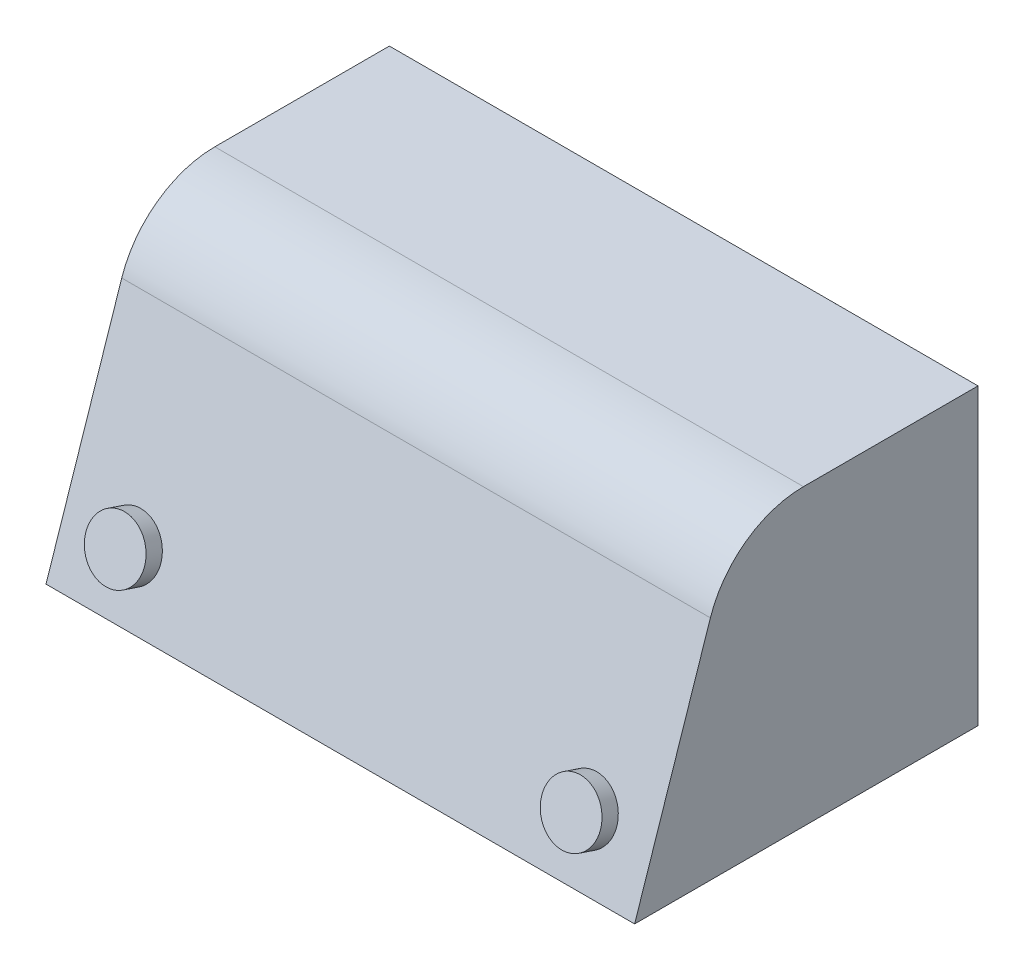
from build123d import *

# Parameters (mm, degrees)
BOSS_EXTRUDE1_DEPTH = 120
FILLET2_R           = 20
SKETCH2_R           = 6
BOSS_EXTRUDE2_DEPTH = 3.5


with BuildPart() as part:
    # Sketch1 → Boss-Extrude1 (new body)
    with BuildSketch(Plane(origin=(0, 0, 0), x_dir=(0, 0, -1), z_dir=(1, 0, 0))):
        Polygon((-70, 0), (0, 0), (0, 60), (-50, 60), align=None)
    extrude(amount=BOSS_EXTRUDE1_DEPTH)

    # Fillet2
    fillet2_edges = [part.edges().sort_by_distance(p)[0] for p in [
        (60, 60, 50),
    ]]
    fillet(fillet2_edges, radius=FILLET2_R)

    # Sketch2 → Boss-Extrude2 (add)
    with BuildSketch(Plane(origin=(0, 21, 63), x_dir=(1, 0, 0), z_dir=(0, 0.316227766016838, 0.9486832980505138))):
        with Locations(Location((13.570097229, -9.935839792, 0), (0, 0, 90))):
            Circle(SKETCH2_R)
        with Locations(Location((106.519183085, -9.935839792, 0), (0, 0, 90))):
            Circle(SKETCH2_R)
    extrude(amount=BOSS_EXTRUDE2_DEPTH)


solid = part.part
